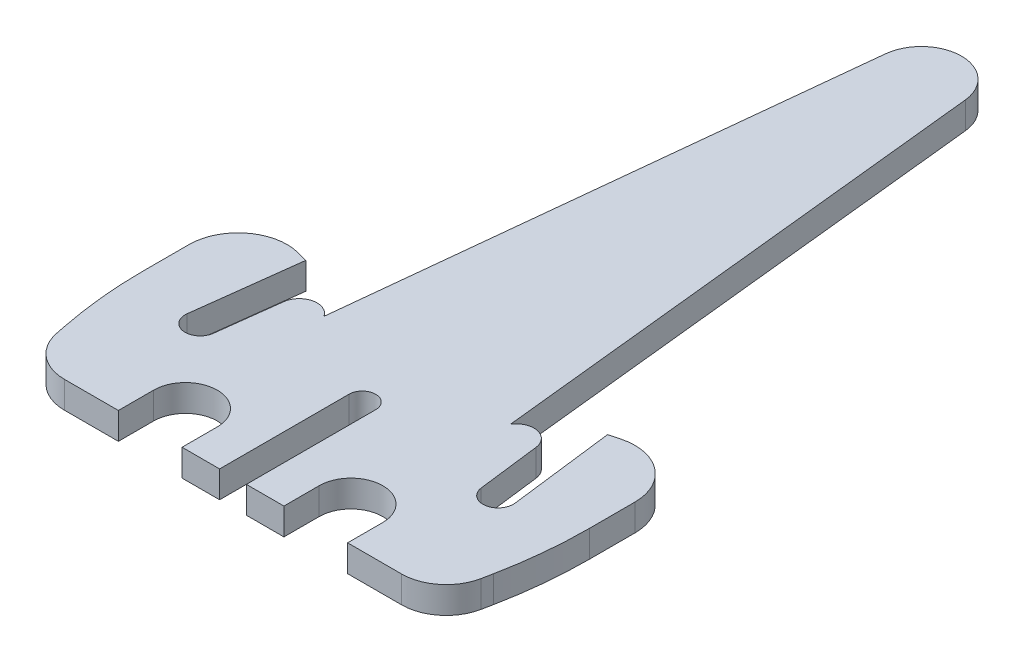
from build123d import *

# Parameters (mm, degrees)
BOSS_EXTRUDE1_DEPTH = 3


with BuildPart() as part:
    # Sketch1 → Boss-Extrude1 (new body)
    with BuildSketch(Plane(origin=(0, 0, 0), x_dir=(1, 0, 0), z_dir=(0, 1, 0))):
        with BuildLine():
            Line((10.463176551, 6.170000059), (4.475348529, 63.140378143))
            ThreePointArc((4.475348529, 63.140378143), (0, 67.170000059), (-4.475348529, 63.140378143))
            Line((-4.475348529, 63.140378143), (-10.463176551, 6.170000059))
            Line((-10.463176551, 6.170000059), (-10.594086082, 6.333950269))
            ThreePointArc((-10.594086082, 6.333950269), (-12.700318865, 7.010801248), (-14.141740272, 5.332513992))
            Line((-14.141740272, 5.332513992), (-15.012961009, -1.682423602))
            ThreePointArc((-15.012961009, -1.682423602), (-16.909521943, -3.15994065), (-18.387038991, -1.263379717))
            Line((-18.387038991, -1.263379717), (-16.916878018, 10.574134051))
            Line((-16.916878018, 10.574134051), (-18.076495252, 10.884852553))
            ThreePointArc((-18.076495252, 10.884852553), (-22.84818786, 9.93570388), (-25, 5.572260508))
            Line((-25, 5.572260508), (-25, 0.469626677))
            ThreePointArc((-25, 0.469626677), (-24.758369054, -4.440028009), (-24.035811635, -9.302229714))
            Line((-24.035811635, -9.302229714), (-23.801666433, -10.47718558))
            ThreePointArc((-23.801666433, -10.47718558), (-22.069368276, -13.365612971), (-18.89808527, -14.499999941))
            Line((-18.89808527, -14.499999941), (-12.85, -14.499999941))
            Line((-12.85, -14.499999941), (-12.85, -10.549999941))
            ThreePointArc((-12.85, -10.549999941), (-9.28, -6.979999941), (-5.71, -10.549999941))
            Line((-5.71, -10.549999941), (-5.71, -14.499999941))
            Line((-5.71, -14.499999941), (-1.500000059, -14.499999941))
            Line((-1.500000059, -14.499999941), (-1.500000059, 0))
            ThreePointArc((-1.500000059, 0), (0, 1.500000059), (1.500000059, 0))
            Line((1.500000059, 0), (1.500000059, -14.499999941))
            Line((1.500000059, -14.499999941), (5.71, -14.499999941))
            Line((5.71, -14.499999941), (5.71, -10.549999941))
            ThreePointArc((5.71, -10.549999941), (9.28, -6.979999941), (12.85, -10.549999941))
            Line((12.85, -10.549999941), (12.85, -14.499999941))
            Line((12.85, -14.499999941), (18.89808527, -14.499999941))
            ThreePointArc((18.89808527, -14.499999941), (22.069368276, -13.365612971), (23.801666433, -10.47718558))
            Line((23.801666433, -10.47718558), (24.035811635, -9.302229714))
            ThreePointArc((24.035811635, -9.302229714), (24.758369054, -4.440028009), (25, 0.469626677))
            Line((25, 0.469626677), (25, 5.572260508))
            ThreePointArc((25, 5.572260508), (22.84818786, 9.93570388), (18.076495252, 10.884852553))
            Line((18.076495252, 10.884852553), (16.916878018, 10.574134051))
            Line((16.916878018, 10.574134051), (18.387038991, -1.263379717))
            ThreePointArc((18.387038991, -1.263379717), (16.909521943, -3.15994065), (15.012961009, -1.682423602))
            Line((15.012961009, -1.682423602), (14.141740272, 5.332513992))
            ThreePointArc((14.141740272, 5.332513992), (12.700318865, 7.010801248), (10.594086082, 6.333950269))
            Line((10.594086082, 6.333950269), (10.463176551, 6.170000059))
        make_face()
    extrude(amount=BOSS_EXTRUDE1_DEPTH)


solid = part.part
